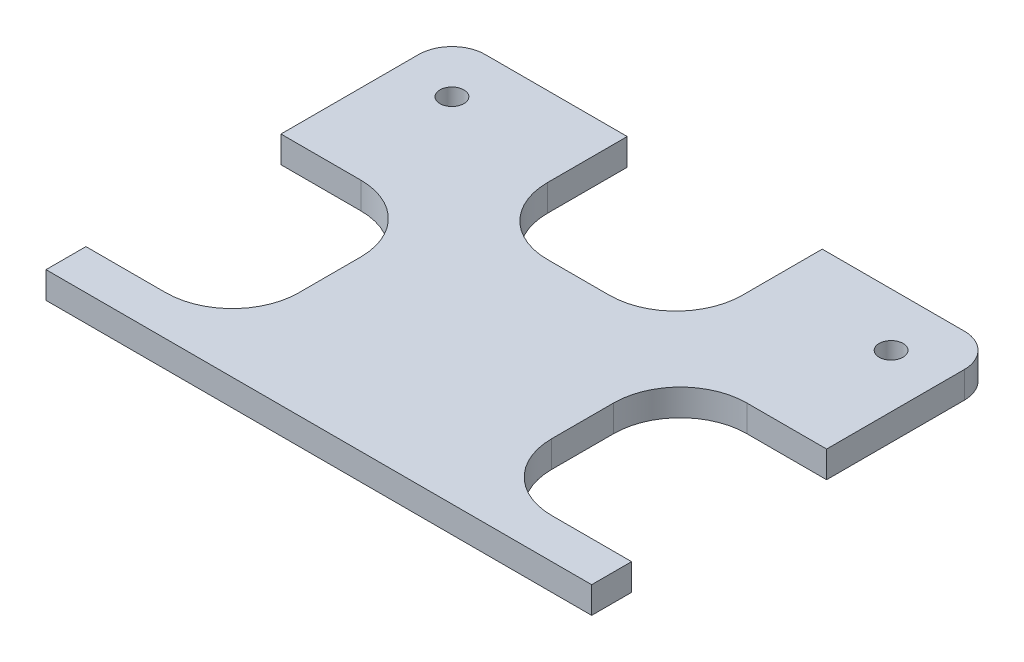
from build123d import *

# Parameters (mm, degrees)
SKETCH1_R           = 1.8
BOSS_EXTRUDE1_DEPTH = 4
SKETCH2_W           = 29.307012988
SKETCH2_H           = 22
SKETCH2_W_2         = 22
SKETCH2_H_2         = 29.307012987
CUT_EXTRUDE1_DEPTH  = 103.279030109
FILLET1_R           = 10


with BuildPart() as part:
    # Sketch1 → Boss-Extrude1 (new body)
    with BuildSketch(Plane(origin=(0, 0, 0), x_dir=(1, 0, 0), z_dir=(0, 1, 0))):
        with BuildLine():
            Line((0, 0), (82, 0))
            Line((82, 0), (82, 56))
            ThreePointArc((82, 56), (80.535533906, 59.535533906), (77, 61))
            Line((77, 61), (5, 61))
            ThreePointArc((5, 61), (1.464466094, 59.535533906), (0, 56))
            Line((0, 56), (0, 0))
        make_face()
        with Locations(Location((8, 53, 0), (0, 0, 270))):
            Circle(SKETCH1_R, mode=Mode.SUBTRACT)
        with Locations(Location((74, 53, 0), (0, 0, 270))):
            Circle(SKETCH1_R, mode=Mode.SUBTRACT)
    extrude(amount=BOSS_EXTRUDE1_DEPTH)

    # Sketch2 → Cut-Extrude1 (cut, through all)
    with BuildSketch(Plane(origin=(0, 4, 0), x_dir=(1, 0, 0), z_dir=(0, 1, 0))):
        with Locations((41, 50)):
            Rectangle(SKETCH2_W, SKETCH2_H)
        with Locations((71, 20.653506494)):
            Rectangle(SKETCH2_W_2, SKETCH2_H_2)
        with Locations((11, 20.653506494)):
            Rectangle(SKETCH2_W_2, SKETCH2_H_2)
    extrude(amount=-CUT_EXTRUDE1_DEPTH, mode=Mode.SUBTRACT)

    # Fillet1
    fillet1_edges = [part.edges().sort_by_distance(p)[0] for p in [
        (26.346493506, 2, -39),
        (55.653506494, 2, -39),
        (60, 2, -6),
        (60, 2, -35.307012987),
        (22, 2, -35.307012987),
        (22, 2, -6),
    ]]
    fillet(fillet1_edges, radius=FILLET1_R)


solid = part.part
